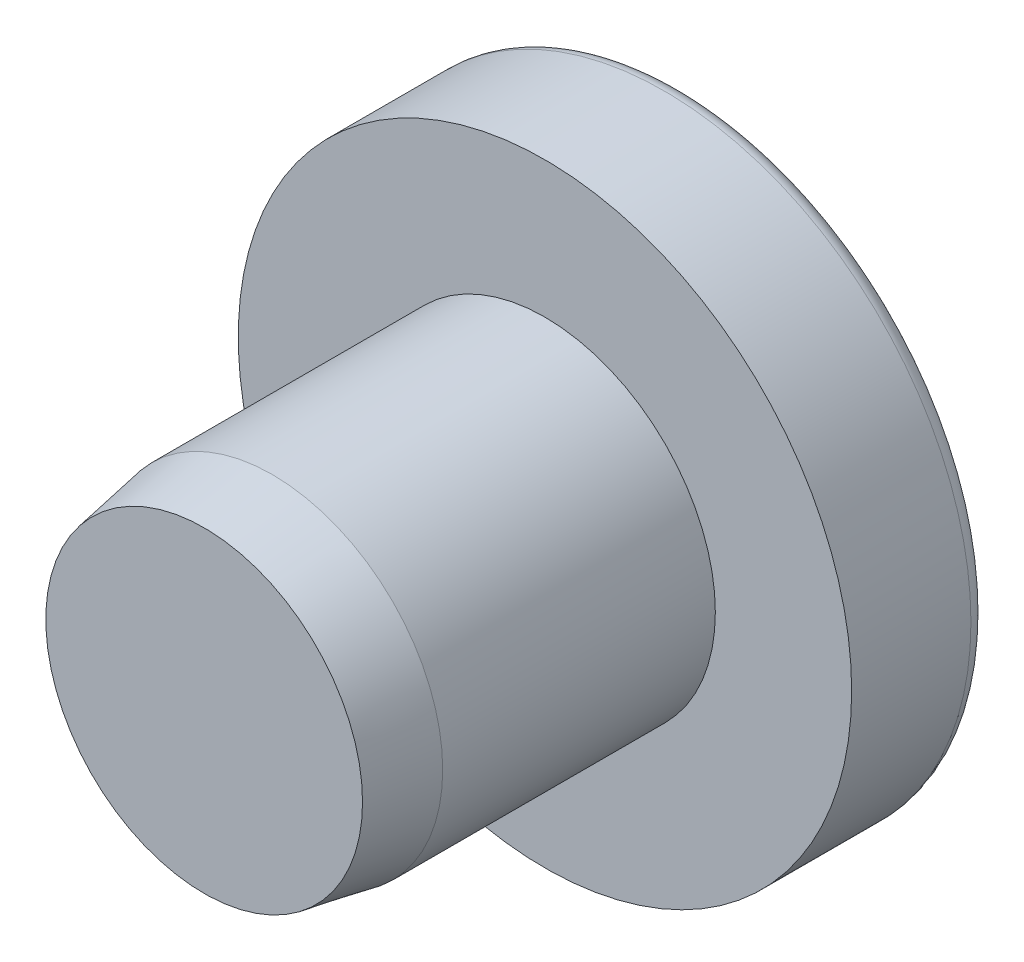
from build123d import *

# Parameters (mm, degrees)
SKETCH_1_R      = 9
EXTRUDE_1_DEPTH = 4
SKETCH_2_R      = 5
EXTRUDE_2_DEPTH = 10
FILLET_1_R      = 0.5
CHAMFER_1_SIZE  = 2
CHAMFER_1_SIZE2 = 0.352653961


with BuildPart() as part:
    # 草图1 → 凸台-拉伸1 (new body)
    with BuildSketch(Plane.XY):
        Circle(SKETCH_1_R)
    extrude(amount=EXTRUDE_1_DEPTH)

    # 草图2 → 凸台-拉伸2 (add)
    with BuildSketch(Plane.XY.offset(4)):
        Circle(SKETCH_2_R)
    extrude(amount=EXTRUDE_2_DEPTH)

    # 圆角1
    fillet_1_edges = [part.edges().sort_by_distance(p)[0] for p in [
        (-9, 0, 0),
    ]]
    fillet(fillet_1_edges, radius=FILLET_1_R)

    # 倒角1
    chamfer_1_edges = [part.edges().sort_by_distance(p)[0] for p in [
        (-5, 0, 14),
    ]]
    chamfer_1_side = [part.faces().sort_by_distance(p)[0] for p in [
        (-5, 0, 9),
    ]]
    chamfer(chamfer_1_edges, length=CHAMFER_1_SIZE, length2=CHAMFER_1_SIZE2, reference=chamfer_1_side[0])


solid = part.part
